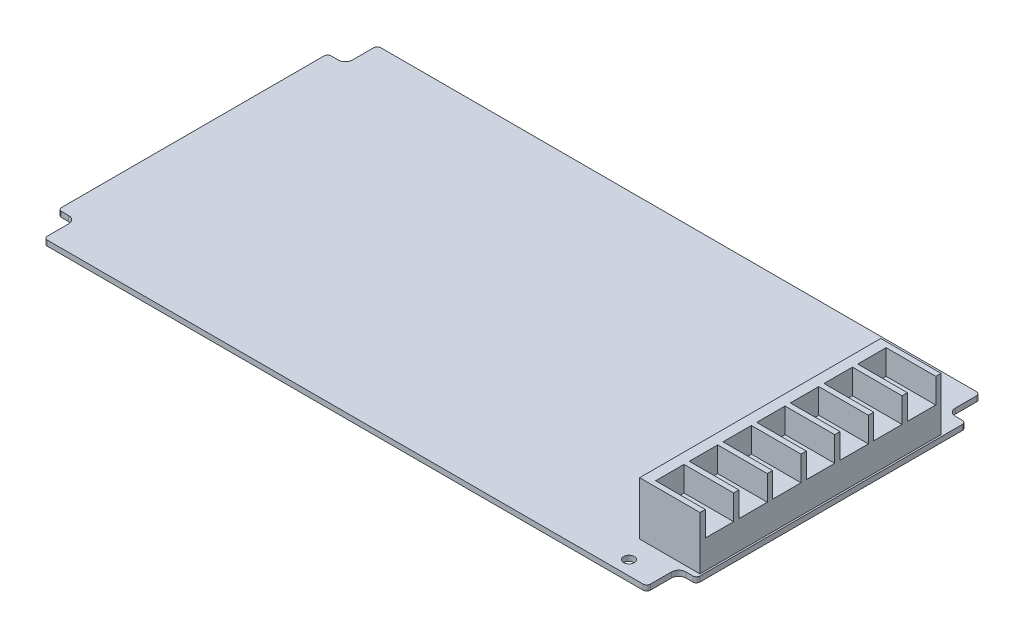
from build123d import *

# Parameters (mm, degrees)
SKETCH_2_W          = 180
SKETCH_2_H          = 94
EXTRUDE_1_DEPTH     = 1.5
CUT_EXTRUDE_1_DEPTH = 1.5
FILLET_1_R          = 1
SKETCH_4_W          = 17
SKETCH_4_H          = 68
EXTRUDE_2_DEPTH     = 15
SKETCH_6_W          = 14
SKETCH_6_H          = 8
CUT_EXTRUDE_3_DEPTH = 7
SKETCH_7_R          = 1.5
CUT_EXTRUDE_4_DEPTH = 8
SKETCH_5_R          = 1.5
CUT_EXTRUDE_2_DEPTH = 103.635276587


with BuildPart() as part:
    # 草图2 → 凸台-拉伸1 (new body)
    with BuildSketch(Plane(origin=(0, 0, 0), x_dir=(1, 0, 0), z_dir=(0, 1, 0))):
        Rectangle(SKETCH_2_W, SKETCH_2_H)
    extrude(amount=EXTRUDE_1_DEPTH)

    # 草图3 → 切除-拉伸1 (cut)
    with BuildSketch(Plane(origin=(0, 1.5, 0), x_dir=(1, 0, 0), z_dir=(0, 1, 0))):
        with BuildLine():
            Line((85, 47), (85, 40))
            ThreePointArc((85, 40), (85.585786438, 38.585786438), (87, 38))
            Line((87, 38), (90, 38))
            Line((90, 38), (90, 47))
            Line((90, 47), (85, 47))
        make_face()
        with BuildLine():
            Line((87, -38), (90, -38))
            Line((90, -38), (90, -47))
            Line((90, -47), (85, -47))
            Line((85, -47), (85, -40))
            ThreePointArc((85, -40), (85.585786438, -38.585786438), (87, -38))
        make_face()
        with BuildLine():
            Line((-90, -47), (-90, -38))
            Line((-90, -38), (-87, -38))
            ThreePointArc((-87, -38), (-85.585786438, -38.585786438), (-85, -40))
            Line((-85, -40), (-85, -47))
            Line((-85, -47), (-90, -47))
        make_face()
        with BuildLine():
            Line((-90, 47), (-90, 38))
            Line((-90, 38), (-87, 38))
            ThreePointArc((-87, 38), (-85.585786438, 38.585786438), (-85, 40))
            Line((-85, 40), (-85, 47))
            Line((-85, 47), (-90, 47))
        make_face()
    extrude(amount=-CUT_EXTRUDE_1_DEPTH, mode=Mode.SUBTRACT)

    # 圆角1
    fillet_1_edges = [part.edges().sort_by_distance(p)[0] for p in [
        (85, 0.75, -47),
        (90, 0.75, -38),
        (90, 0.75, 38),
        (85, 0.75, 47),
        (-85, 0.75, 47),
        (-90, 0.75, 38),
        (-90, 0.75, -38),
        (-85, 0.75, -47),
    ]]
    fillet(fillet_1_edges, radius=FILLET_1_R)

    # 草图4 → 凸台-拉伸2 (add)
    with BuildSketch(Plane(origin=(0, 1.5, 0), x_dir=(1, 0, 0), z_dir=(0, 1, 0))):
        with Locations((81, -2.5)):
            Rectangle(SKETCH_4_W, SKETCH_4_H)
    extrude(amount=EXTRUDE_2_DEPTH)

    # 草图6 → 切除-拉伸3 (cut)
    with BuildSketch(Plane(origin=(0, 16.5, 0), x_dir=(1, 0, 0), z_dir=(0, 1, 0))):
        with Locations((82.5, 26)):
            Rectangle(SKETCH_6_W, SKETCH_6_H)
        with Locations((82.5, 16.5)):
            Rectangle(SKETCH_6_W, SKETCH_6_H)
        with Locations((82.5, 7)):
            Rectangle(SKETCH_6_W, SKETCH_6_H)
        with Locations((82.5, -2.5)):
            Rectangle(SKETCH_6_W, SKETCH_6_H)
        with Locations((82.5, -12)):
            Rectangle(SKETCH_6_W, SKETCH_6_H)
        with Locations((82.5, -21.5)):
            Rectangle(SKETCH_6_W, SKETCH_6_H)
        with Locations((82.5, -31)):
            Rectangle(SKETCH_6_W, SKETCH_6_H)
    extrude(amount=-CUT_EXTRUDE_3_DEPTH, mode=Mode.SUBTRACT)

    # 草图7 → 切除-拉伸4 (cut)
    with BuildSketch(Plane(origin=(0, 9.5, 0), x_dir=(1, 0, 0), z_dir=(0, 1, 0))):
        with Locations(Location((82.5, 26, 0), (0, 0, 270))):
            Circle(SKETCH_7_R)
        with Locations(Location((82.5, 16.5, 0), (0, 0, 270))):
            Circle(SKETCH_7_R)
        with Locations(Location((82.5, 7, 0), (0, 0, 270))):
            Circle(SKETCH_7_R)
        with Locations(Location((82.5, -2.5, 0), (0, 0, 270))):
            Circle(SKETCH_7_R)
        with Locations(Location((82.5, -12, 0), (0, 0, 270))):
            Circle(SKETCH_7_R)
        with Locations(Location((82.5, -21.5, 0), (0, 0, 270))):
            Circle(SKETCH_7_R)
        with Locations(Location((82.5, -31, 0), (0, 0, 270))):
            Circle(SKETCH_7_R)
    extrude(amount=-CUT_EXTRUDE_4_DEPTH, mode=Mode.SUBTRACT)

    # 草图5 → 切除-拉伸2 (cut, through all)
    with BuildSketch(Plane(origin=(0, 1.5, 0), x_dir=(1, 0, 0), z_dir=(0, 1, 0))):
        with Locations(Location((76, -43, 0), (0, 0, 270))):
            Circle(SKETCH_5_R)
    extrude(amount=-CUT_EXTRUDE_2_DEPTH, mode=Mode.SUBTRACT)


solid = part.part
